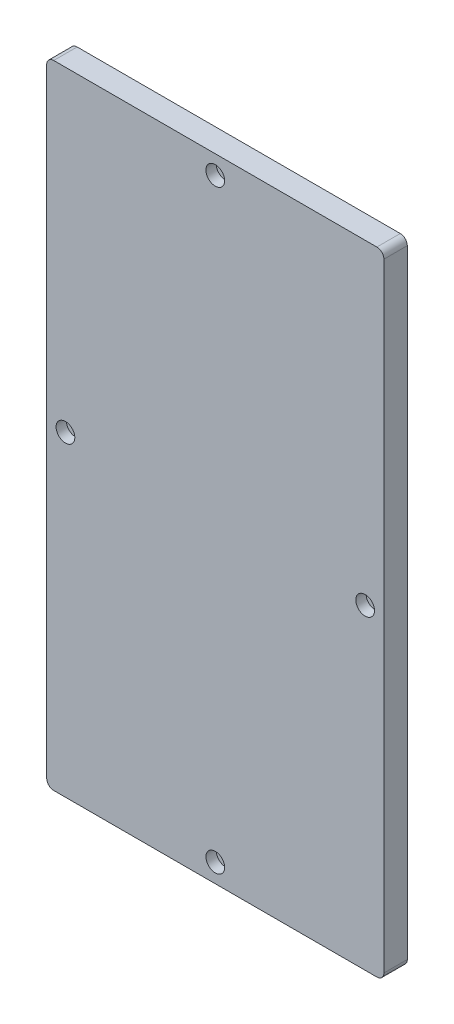
from build123d import *

# Parameters (mm, degrees)
SKETCH1_W                                    = 144
SKETCH1_H                                    = 270
BOSS_EXTRUDE1_DEPTH                          = 10
CBORE_FOR_M4_HEX_SOCKET_HEAD_CAP_SCR_2_COUNT = 2
CBORE_FOR_M4_HEX_SOCKET_HEAD_CAP_SCR_2_PITCH = 142.214626533
CBORE_FOR_M4_HEX_SOCKET_HEAD_CAP_SCR_3_COUNT = 2
CBORE_FOR_M4_HEX_SOCKET_HEAD_CAP_SCR_3_PITCH = 254
CBORE_FOR_M4_HEX_SOCKET_HEAD_CAP_SCR_4_COUNT = 2
CBORE_FOR_M4_HEX_SOCKET_HEAD_CAP_SCR_4_PITCH = 142.214626533
CUT_EXTRUDE1_REACH                           = 160.326
CUT_EXTRUDE1_START                           = -5
FILLET1_R                                    = 3


with BuildPart() as part:
    # Sketch1 → Boss-Extrude1 (new body)
    with BuildSketch(Plane.XY):
        Rectangle(SKETCH1_W, SKETCH1_H)
    extrude(amount=BOSS_EXTRUDE1_DEPTH)

    # Sketch3 → CBORE for M4 Hex Socket Head Cap Screw1 (revolve, cut)
    with BuildSketch(Plane(origin=(0, 127, 10), x_dir=(0, -1, 0), z_dir=(1, 0, 0))):
        Polygon((0, 0), (0, 10), (2.275, 10), (2.25, 9.975), (2.25, 4.4), (4, 4.4), (4, 0), align=None)
    cbore_for_m4_hex_socket_head_cap_screw1 = revolve(axis=Axis((0, 127, 16.35), (0, 0, -1)), mode=Mode.SUBTRACT)

    # CBORE for M4 Hex Socket Head Cap Scr 2: CBORE for M4 Hex Socket Head Cap Screw1 ×2
    with Locations(*[Vector(-0.4500240345181632, -0.8930164434969801, 0) * (i * CBORE_FOR_M4_HEX_SOCKET_HEAD_CAP_SCR_2_PITCH) for i in range(1, CBORE_FOR_M4_HEX_SOCKET_HEAD_CAP_SCR_2_COUNT)]):
        add(cbore_for_m4_hex_socket_head_cap_screw1, mode=Mode.SUBTRACT)

    # CBORE for M4 Hex Socket Head Cap Scr 3: CBORE for M4 Hex Socket Head Cap Screw1 ×2
    with Locations(*[(0, -i * CBORE_FOR_M4_HEX_SOCKET_HEAD_CAP_SCR_3_PITCH, 0) for i in range(1, CBORE_FOR_M4_HEX_SOCKET_HEAD_CAP_SCR_3_COUNT)]):
        add(cbore_for_m4_hex_socket_head_cap_screw1, mode=Mode.SUBTRACT)

    # CBORE for M4 Hex Socket Head Cap Scr 4: CBORE for M4 Hex Socket Head Cap Screw1 ×2
    with Locations(*[Vector(0.4500240345181632, -0.8930164434969801, 0) * (i * CBORE_FOR_M4_HEX_SOCKET_HEAD_CAP_SCR_4_PITCH) for i in range(1, CBORE_FOR_M4_HEX_SOCKET_HEAD_CAP_SCR_4_COUNT)]):
        add(cbore_for_m4_hex_socket_head_cap_screw1, mode=Mode.SUBTRACT)

    # Sketch4 → Cut-Extrude1 (cut, up to next)
    with BuildSketch(Plane.XY.offset(10).offset(CUT_EXTRUDE1_START), mode=Mode.PRIVATE) as cut_extrude1_sk1:
        with BuildLine():
            Line((-67, -6.32455532), (-67, -130))
            Line((-67, -130), (-6.32455532, -130))
            ThreePointArc((-6.32455532, -130), (0, -120), (6.32455532, -130))
            Line((6.32455532, -130), (67, -130))
            Line((67, -130), (67, -6.32455532))
            ThreePointArc((67, -6.32455532), (57, 0), (67, 6.32455532))
            Line((67, 6.32455532), (67, 130))
            Line((67, 130), (6.32455532, 130))
            ThreePointArc((6.32455532, 130), (0, 120), (-6.32455532, 130))
            Line((-6.32455532, 130), (-67, 130))
            Line((-67, 130), (-67, 6.32455532))
            ThreePointArc((-67, 6.32455532), (-57, 0), (-67, -6.32455532))
        make_face()
    cut_extrude1_tool1 = extrude(cut_extrude1_sk1.sketch, amount=-CUT_EXTRUDE1_REACH, mode=Mode.PRIVATE) & part.part
    add(cut_extrude1_tool1.solids().sort_by_distance((0, 0, 5))[0], mode=Mode.SUBTRACT)

    # Fillet1
    fillet1_edges = [part.edges().sort_by_distance(p)[0] for p in [
        (-72, 135, 5),
        (72, 135, 5),
        (72, -135, 5),
        (-72, -135, 5),
    ]]
    fillet(fillet1_edges, radius=FILLET1_R)


solid = part.part
